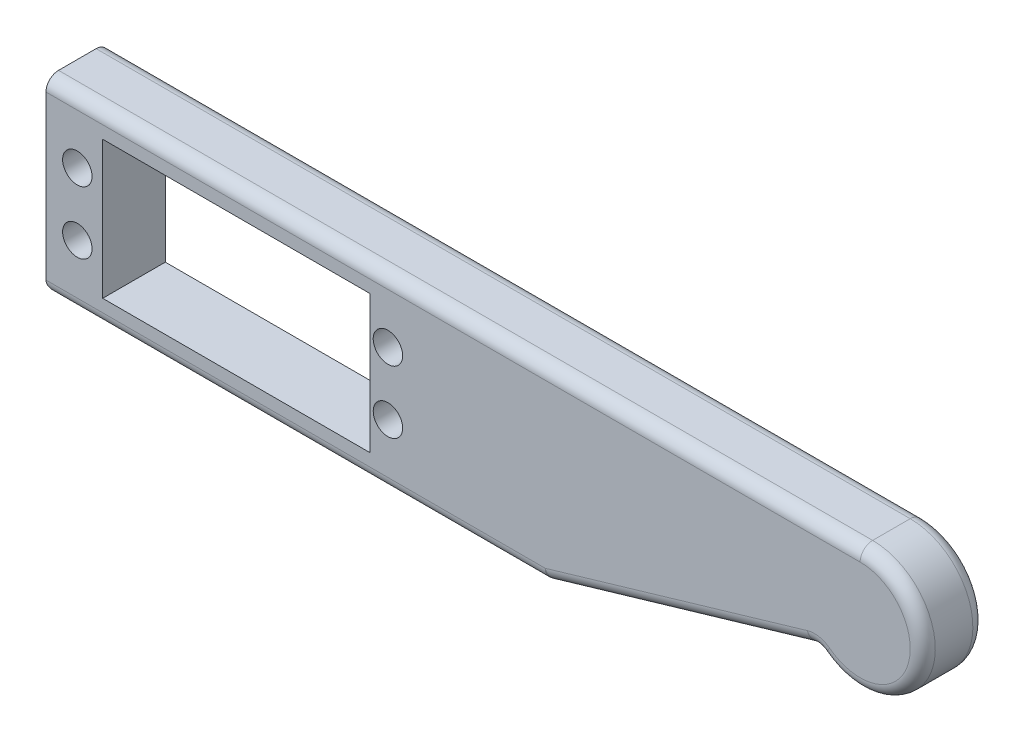
from build123d import *

# Parameters (mm, degrees)
SKETCH1_R           = 2.35
SKETCH1_W           = 41.5
SKETCH1_H           = 22
BOSS_EXTRUDE1_DEPTH = 10
FILLET1_R           = 2
CHAMFER1_SIZE       = 2
CHAMFER1_SIZE2      = 1.154700538


with BuildPart() as part:
    # Sketch1 → Boss-Extrude1 (new body)
    with BuildSketch(Plane.XY):
        with BuildLine():
            Line((-70, 15), (60, 15))
            ThreePointArc((60, 15), (69.302333621, 1.330314836), (53.172672864, -2.306682159))
            Line((53.172672864, -2.306682159), (10, -15))
            Line((10, -15), (-70, -15))
            Line((-70, -15), (-70, 15))
        make_face()
        with Locations((-65, 5)):
            Circle(SKETCH1_R, mode=Mode.SUBTRACT)
        with Locations((-15.4, 5)):
            Circle(SKETCH1_R, mode=Mode.SUBTRACT)
        with Locations(Location((-15.4, -5, 0), (0, 0, 180))):
            Circle(SKETCH1_R, mode=Mode.SUBTRACT)
        with Locations(Location((-65, -5, 0), (0, 0, 180))):
            Circle(SKETCH1_R, mode=Mode.SUBTRACT)
        with Locations((-40.2, 0)):
            Rectangle(SKETCH1_W, SKETCH1_H, mode=Mode.SUBTRACT)
    extrude(amount=BOSS_EXTRUDE1_DEPTH)

    # Fillet1
    fillet1_edges = [part.edges().sort_by_distance(p)[0] for p in [
        (31.586336432, -8.653341079, 10),
        (69.302333621, 1.330314836, 10),
        (-5, 15, 10),
        (-5, 15, 0),
        (69.302333621, 1.330314836, 0),
        (31.586336432, -8.653341079, 0),
        (-30, -15, 0),
        (-30, -15, 10),
        (53.172672864, -2.306682159, 5),
        (10, -15, 5),
        (-70, -15, 5),
    ]]
    fillet(fillet1_edges, radius=FILLET1_R)

    # Chamfer1
    chamfer1_edges = [part.edges().sort_by_distance(p)[0] for p in [
        (-19.45, 0, 10),
    ]]
    chamfer1_side = [part.faces().sort_by_distance(p)[0] for p in [
        (-19.45, 0, 5),
    ]]
    chamfer(chamfer1_edges, length=CHAMFER1_SIZE, length2=CHAMFER1_SIZE2, reference=chamfer1_side[0])


solid = part.part
